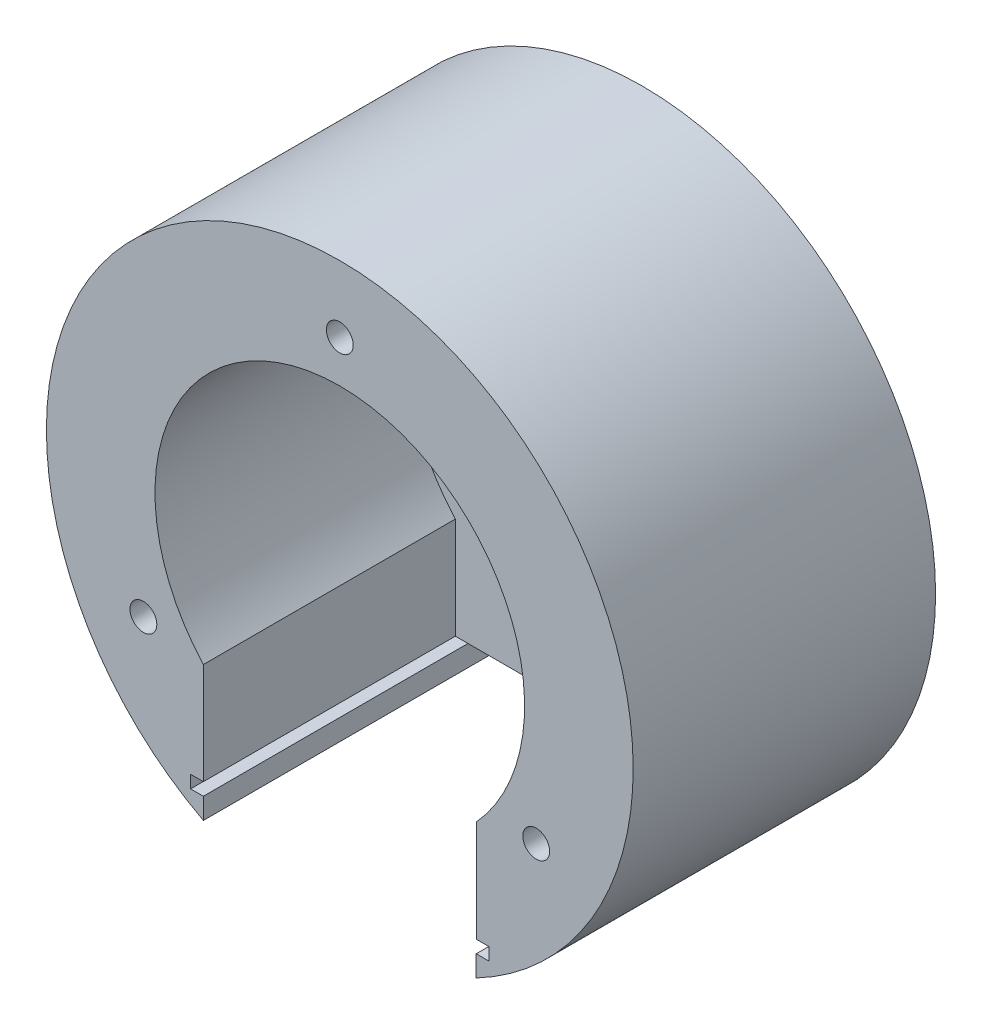
from build123d import *

# Parameters (mm, degrees)
SKETCH2_R           = 17.4625
BOSS_EXTRUDE1_DEPTH = 18
SKETCH13_R          = 0.8
CUT_EXTRUDE6_DEPTH  = 10
SKETCH16_R          = 11
CUT_EXTRUDE9_DEPTH  = 15
CUT_EXTRUDE11_DEPTH = 22
SKETCH21_W          = 16.25
SKETCH21_H          = 2.78436417
CUT_EXTRUDE12_DEPTH = 31.559414466
CUT_EXTRUDE13_REACH = 32.559
SKETCH24_W          = 16.25
SKETCH24_H          = 6.70136321
CUT_EXTRUDE14_DEPTH = 17


with BuildPart() as part:
    # Sketch2 → Boss-Extrude1 (new body)
    with BuildSketch(Plane.XY):
        Circle(SKETCH2_R)
    extrude(amount=BOSS_EXTRUDE1_DEPTH)

    # Sketch13 → Cut-Extrude6 (cut)
    with BuildSketch(Plane.XY.offset(18)):
        with Locations((0, 13.5)):
            Circle(SKETCH13_R)
        with Locations((11.691342951, -6.75)):
            Circle(SKETCH13_R)
        with Locations((-11.691342951, -6.75)):
            Circle(SKETCH13_R)
    extrude(amount=-CUT_EXTRUDE6_DEPTH, mode=Mode.SUBTRACT)

    # Sketch16 → Cut-Extrude9 (cut)
    with BuildSketch(Plane.XY.offset(18)):
        Circle(SKETCH16_R)
    extrude(amount=-CUT_EXTRUDE9_DEPTH, mode=Mode.SUBTRACT)

    # Sketch20 → Cut-Extrude11 (cut)
    with BuildSketch(Plane(origin=(5.95728493, 0, -11.08430825), x_dir=(0, 0, 1), z_dir=(0, 1, 0))):
        Polygon((16.52930825, -11.021800725), (16.52930825, -6.906800725), (14.92930825, -6.906800725), (14.92930825, -4.926800725), (16.52930825, -4.926800725), (16.52930825, -0.811800725), (18.05430825, -0.811800725), (18.05430825, 1.028199275), (22.11430825, 1.028199275), (22.11430825, -0.811800725), (23.63930825, -0.811800725), (23.63930825, -11.021800725), (22.11430825, -11.021800725), (22.11430825, -12.861800725), (18.05430825, -12.861800725), (18.05430825, -11.021800725), align=None)
    extrude(amount=-CUT_EXTRUDE11_DEPTH, mode=Mode.SUBTRACT)

    # Sketch21 → Cut-Extrude12 (cut, through all)
    with BuildSketch(Plane.XY.offset(18)):
        with Locations((0, -16.852182085)):
            Rectangle(SKETCH21_W, SKETCH21_H)
    extrude(amount=-CUT_EXTRUDE12_DEPTH, mode=Mode.SUBTRACT)

    # Cut-Extrude13: up to this face of the body (flat: up to its plane)
    cut_extrude13_end = Plane(part.part.faces().sort_by_distance((0, 0, 3))[0])
    # Sketch24 → Cut-Extrude13 (cut, up to the picked face)
    with BuildSketch(Plane.XY.offset(18), mode=Mode.PRIVATE) as cut_extrude13_sk1:
        with Locations((0.005436819, -10.109318395)):
            Rectangle(SKETCH24_W, SKETCH24_H)
    cut_extrude13_tool1 = split(extrude(cut_extrude13_sk1.sketch, amount=-CUT_EXTRUDE13_REACH, mode=Mode.PRIVATE), bisect_by=cut_extrude13_end, keep=Keep.BOTH, mode=Mode.PRIVATE)
    add(cut_extrude13_tool1.solids().sort_by(Axis((0.005437, -10.109318, 18), (0, 0, -1)))[0], mode=Mode.SUBTRACT)

    # Sketch26 → Cut-Extrude14 (cut)
    with BuildSketch(Plane.XY.offset(18)):
        Polygon((-8.119563181, -14.21), (-8.119563181, -15.46), (8.119563181, -15.46), (8.119563181, -14.21), (8.890436819, -14.21), (8.890436819, -13.46), (8.130436819, -13.46), (-8.119563181, -13.46), (-8.879563181, -13.46), (-8.879563181, -14.21), align=None)
    extrude(amount=-CUT_EXTRUDE14_DEPTH, mode=Mode.SUBTRACT)


solid = part.part
